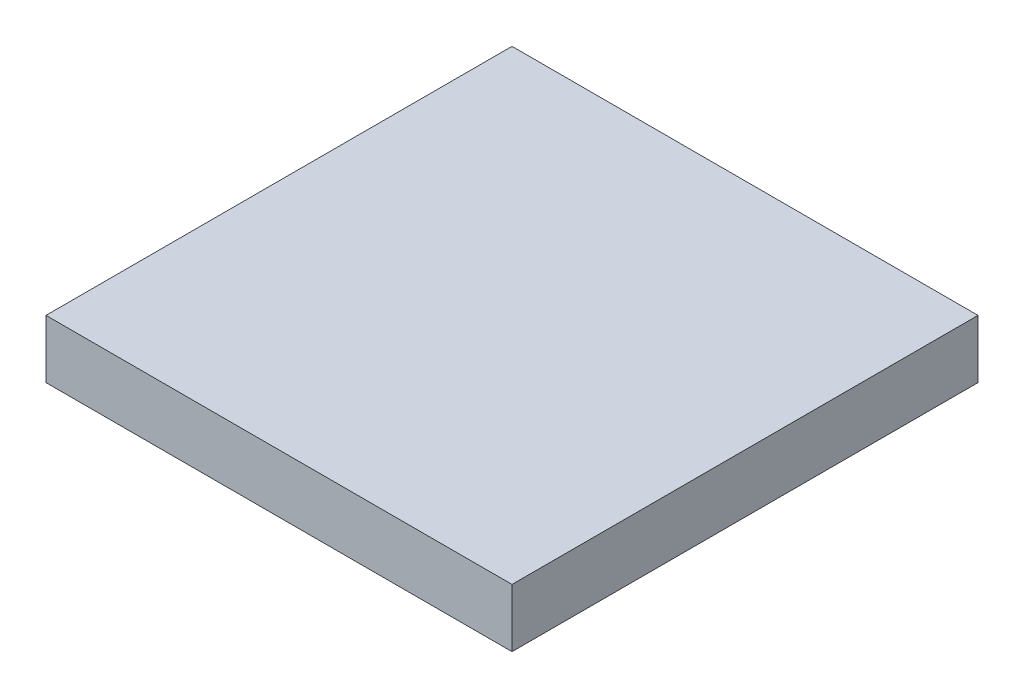
from build123d import *

# Parameters (mm, degrees)
SKETCH1_W           = 101.6
SKETCH1_H           = 101.6
BOSS_EXTRUDE1_DEPTH = 12.7


with BuildPart() as part:
    # Sketch1 → Boss-Extrude1 (new body)
    with BuildSketch(Plane(origin=(0, 0, 0), x_dir=(1, 0, 0), z_dir=(0, 1, 0))):
        with Locations((12.201385681, -9.503002309)):
            Rectangle(SKETCH1_W, SKETCH1_H)
    extrude(amount=BOSS_EXTRUDE1_DEPTH)


solid = part.part
